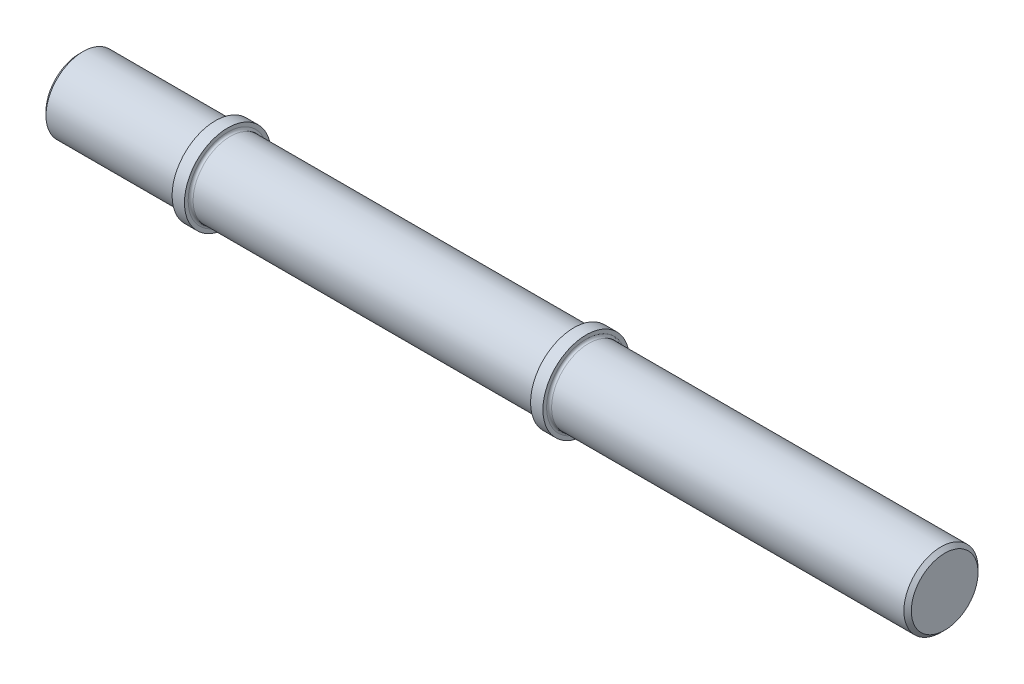
from build123d import *

# Parameters (mm, degrees)
SKETCH1_W     = 18
SKETCH1_H     = 3
SKETCH1_W_2   = 2
SKETCH1_W_3   = 10
SKETCH1_W_4   = 12
FILLET1_R     = 0.2
CHAMFER1_SIZE = 0.3


with BuildPart() as part:
    # Sketch1 → Revolve1 (revolve)
    with BuildSketch(Plane.XY, mode=Mode.PRIVATE) as revolve1_sk:
        Polygon((20, 3), (12, 3), (12, 3.5), (11, 3.5), (11, 3), (0, 3), (0, 0), (20, 0), align=None)
        with Locations((29, 1.5)):
            Rectangle(SKETCH1_W, SKETCH1_H)
        with Locations((39, 1.5)):
            Rectangle(SKETCH1_W_2, SKETCH1_H)
        Polygon((40, 3.5), (40, 3), (40, 0), (48, 0), (48, 3), (41, 3), (41, 3.5), align=None)
        with Locations((53, 1.5)):
            Rectangle(SKETCH1_W_3, SKETCH1_H)
        with Locations((64, 1.5)):
            Rectangle(SKETCH1_W_4, SKETCH1_H)
    revolve(revolve1_sk.sketch.rotate(Axis((0, 0, 0), (1, 0, 0)), 90), axis=Axis((0, 0, 0), (1, 0, 0)))

    # Fillet1
    fillet1_edges = [part.edges().sort_by_distance(p)[0] for p in [
        (11, 0, -3),
        (12, 0, -3),
        (40, 0, -3),
        (41, 0, -3),
    ]]
    fillet(fillet1_edges, radius=FILLET1_R)

    # Chamfer1
    chamfer1_edges = [part.edges().sort_by_distance(p)[0] for p in [
        (0, 0, -3),
        (70, 0, -3),
    ]]
    chamfer(chamfer1_edges, length=CHAMFER1_SIZE)


solid = part.part
